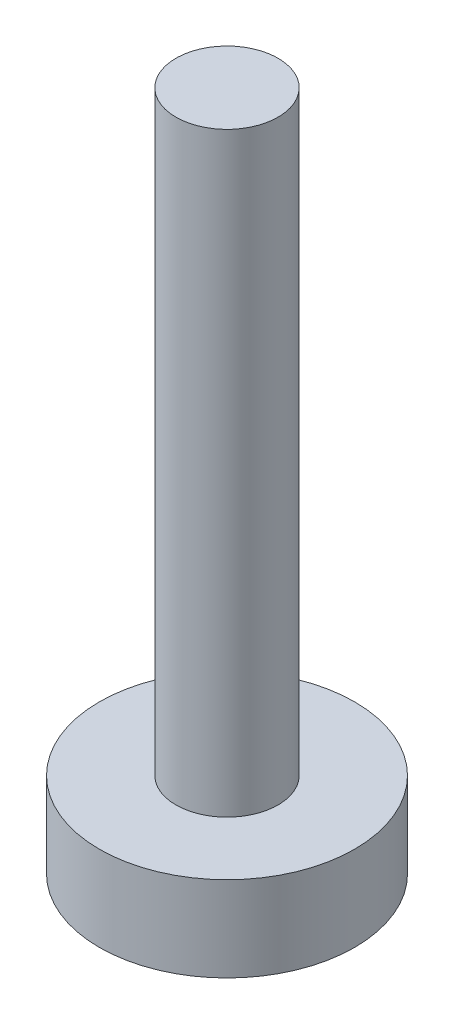
from build123d import *

# Parameters (mm, degrees)
SKETCH1_R           = 0.6
BOSS_EXTRUDE1_DEPTH = 7
SKETCH2_R           = 1.5
BOSS_EXTRUDE2_DEPTH = 1


with BuildPart() as part:
    # Sketch1 → Boss-Extrude1 (new body)
    with BuildSketch(Plane(origin=(0, 0, 0), x_dir=(1, 0, 0), z_dir=(0, 1, 0))):
        with Locations(Location((0, 0, 0), (0, 0, 270))):
            Circle(SKETCH1_R)
    extrude(amount=BOSS_EXTRUDE1_DEPTH)

    # Sketch2 → Boss-Extrude2 (add)
    with BuildSketch(Plane.XZ):
        with Locations(Location((0, 0, 0), (0, 0, 270))):
            Circle(SKETCH2_R)
    extrude(amount=BOSS_EXTRUDE2_DEPTH)


solid = part.part
